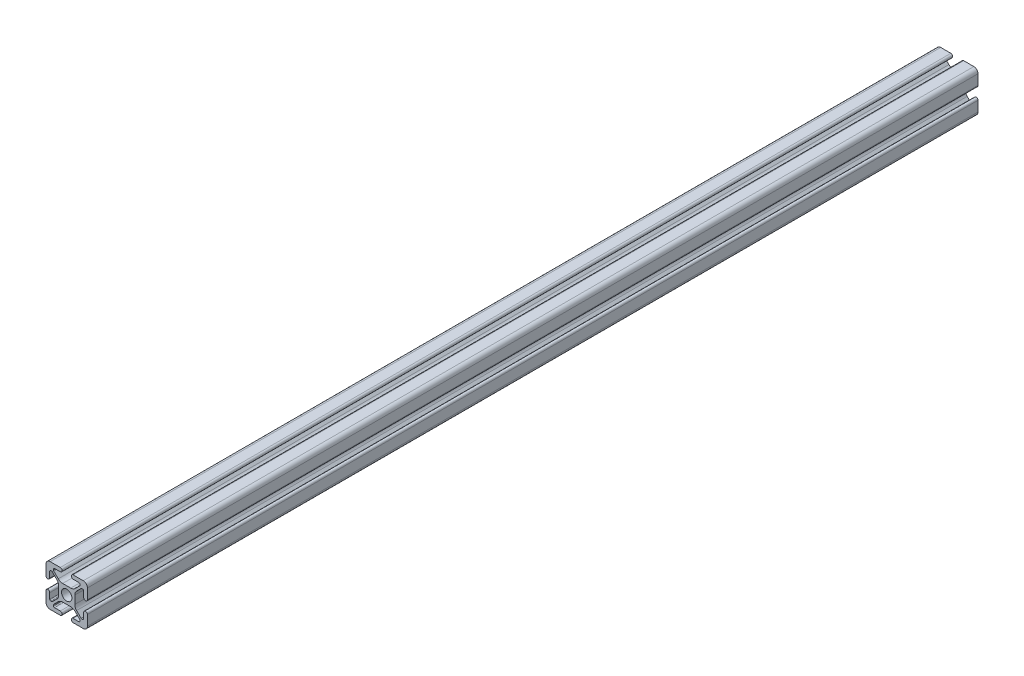
from build123d import *

# Parameters (mm, degrees)
SKETCH_2_R      = 2.5
EXTRUDE_1_DEPTH = 430


with BuildPart() as part:
    # 草图2 → 凸台-拉伸1 (new body)
    with BuildSketch(Plane.XY):
        with BuildLine():
            Line((-1.042752475, -10.085861632), (3.857247525, -10.085861632))
            ThreePointArc((3.857247525, -10.085861632), (4.757247525, -10.985861632), (3.857247525, -11.885861632))
            Line((3.857247525, -11.885861632), (1.076161722, -11.885861632))
            ThreePointArc((1.076161722, -11.885861632), (0.722608332, -12.032308241), (0.576161722, -12.385861632))
            Line((0.576161722, -12.385861632), (0.576161722, -12.790788968))
            ThreePointArc((0.576161722, -12.790788968), (0.614221956, -12.982130685), (0.722608332, -13.144342359))
            Line((0.722608332, -13.144342359), (2.885447948, -15.307181975))
            ThreePointArc((2.885447948, -15.307181975), (3.858717994, -15.957500229), (5.006768291, -16.185861632))
            Line((5.006768291, -16.185861632), (8.907726758, -16.185861632))
            ThreePointArc((8.907726758, -16.185861632), (10.055777055, -15.957500229), (11.029047102, -15.307181975))
            Line((11.029047102, -15.307181975), (13.191886718, -13.144342359))
            ThreePointArc((13.191886718, -13.144342359), (13.300273094, -12.982130685), (13.338333327, -12.790788968))
            Line((13.338333327, -12.790788968), (13.338333327, -12.385861632))
            ThreePointArc((13.338333327, -12.385861632), (13.191886718, -12.032308241), (12.838333327, -11.885861632))
            Line((12.838333327, -11.885861632), (10.057247525, -11.885861632))
            ThreePointArc((10.057247525, -11.885861632), (9.157247525, -10.985861632), (10.057247525, -10.085861632))
            Line((10.057247525, -10.085861632), (14.957247525, -10.085861632))
            ThreePointArc((14.957247525, -10.085861632), (16.371461087, -10.671648069), (16.957247525, -12.085861632))
            Line((16.957247525, -12.085861632), (16.957247525, -16.985861632))
            ThreePointArc((16.957247525, -16.985861632), (16.057247525, -17.885861632), (15.157247525, -16.985861632))
            Line((15.157247525, -16.985861632), (15.157247525, -14.204775829))
            ThreePointArc((15.157247525, -14.204775829), (15.010800915, -13.851222438), (14.657247525, -13.704775829))
            Line((14.657247525, -13.704775829), (14.252320188, -13.704775829))
            ThreePointArc((14.252320188, -13.704775829), (14.060978472, -13.742836063), (13.898766797, -13.851222438))
            Line((13.898766797, -13.851222438), (11.735927181, -16.014062054))
            ThreePointArc((11.735927181, -16.014062054), (11.085608927, -16.987332101), (10.857247525, -18.135382398))
            Line((10.857247525, -18.135382398), (10.857247525, -22.036340865))
            ThreePointArc((10.857247525, -22.036340865), (11.085608927, -23.184391162), (11.735927181, -24.157661209))
            Line((11.735927181, -24.157661209), (13.898766797, -26.320500825))
            ThreePointArc((13.898766797, -26.320500825), (14.060978472, -26.4288872), (14.252320188, -26.466947434))
            Line((14.252320188, -26.466947434), (14.657247525, -26.466947434))
            ThreePointArc((14.657247525, -26.466947434), (15.010800915, -26.320500825), (15.157247525, -25.966947434))
            Line((15.157247525, -25.966947434), (15.157247525, -23.185861632))
            ThreePointArc((15.157247525, -23.185861632), (16.057247525, -22.285861632), (16.957247525, -23.185861632))
            Line((16.957247525, -23.185861632), (16.957247525, -28.085861632))
            ThreePointArc((16.957247525, -28.085861632), (16.371461087, -29.500075194), (14.957247525, -30.085861632))
            Line((14.957247525, -30.085861632), (10.057247525, -30.085861632))
            ThreePointArc((10.057247525, -30.085861632), (9.157247525, -29.185861632), (10.057247525, -28.285861632))
            Line((10.057247525, -28.285861632), (12.838333327, -28.285861632))
            ThreePointArc((12.838333327, -28.285861632), (13.191886718, -28.139415022), (13.338333327, -27.785861632))
            Line((13.338333327, -27.785861632), (13.338333327, -27.380934295))
            ThreePointArc((13.338333327, -27.380934295), (13.300273094, -27.189592579), (13.191886718, -27.027380904))
            Line((13.191886718, -27.027380904), (11.029047102, -24.864541288))
            ThreePointArc((11.029047102, -24.864541288), (10.055777055, -24.214223034), (8.907726758, -23.985861632))
            Line((8.907726758, -23.985861632), (5.006768291, -23.985861632))
            ThreePointArc((5.006768291, -23.985861632), (3.858717994, -24.214223034), (2.885447948, -24.864541288))
            Line((2.885447948, -24.864541288), (0.722608332, -27.027380904))
            ThreePointArc((0.722608332, -27.027380904), (0.614221956, -27.189592579), (0.576161722, -27.380934295))
            Line((0.576161722, -27.380934295), (0.576161722, -27.785861632))
            ThreePointArc((0.576161722, -27.785861632), (0.722608332, -28.139415022), (1.076161722, -28.285861632))
            Line((1.076161722, -28.285861632), (3.857247525, -28.285861632))
            ThreePointArc((3.857247525, -28.285861632), (4.757247525, -29.185861632), (3.857247525, -30.085861632))
            Line((3.857247525, -30.085861632), (-1.042752475, -30.085861632))
            ThreePointArc((-1.042752475, -30.085861632), (-2.456966038, -29.500075194), (-3.042752475, -28.085861632))
            Line((-3.042752475, -28.085861632), (-3.042752475, -23.185861632))
            ThreePointArc((-3.042752475, -23.185861632), (-2.142752475, -22.285861632), (-1.242752475, -23.185861632))
            Line((-1.242752475, -23.185861632), (-1.242752475, -25.966947434))
            ThreePointArc((-1.242752475, -25.966947434), (-1.096305866, -26.320500825), (-0.742752475, -26.466947434))
            Line((-0.742752475, -26.466947434), (-0.337825138, -26.466947434))
            ThreePointArc((-0.337825138, -26.466947434), (-0.146483422, -26.4288872), (0.015728252, -26.320500825))
            Line((0.015728252, -26.320500825), (2.178567868, -24.157661209))
            ThreePointArc((2.178567868, -24.157661209), (2.828886122, -23.184391162), (3.057247525, -22.036340865))
            Line((3.057247525, -22.036340865), (3.057247525, -18.135382398))
            ThreePointArc((3.057247525, -18.135382398), (2.828886122, -16.987332101), (2.178567868, -16.014062054))
            Line((2.178567868, -16.014062054), (0.015728252, -13.851222438))
            ThreePointArc((0.015728252, -13.851222438), (-0.146483422, -13.742836063), (-0.337825138, -13.704775829))
            Line((-0.337825138, -13.704775829), (-0.742752475, -13.704775829))
            ThreePointArc((-0.742752475, -13.704775829), (-1.096305866, -13.851222438), (-1.242752475, -14.204775829))
            Line((-1.242752475, -14.204775829), (-1.242752475, -16.985861632))
            ThreePointArc((-1.242752475, -16.985861632), (-2.142752475, -17.885861632), (-3.042752475, -16.985861632))
            Line((-3.042752475, -16.985861632), (-3.042752475, -12.085861632))
            ThreePointArc((-3.042752475, -12.085861632), (-2.456966038, -10.671648069), (-1.042752475, -10.085861632))
        make_face()
        with Locations((6.957247525, -20.085861632)):
            Circle(SKETCH_2_R, mode=Mode.SUBTRACT)
    extrude(amount=EXTRUDE_1_DEPTH)


solid = part.part
